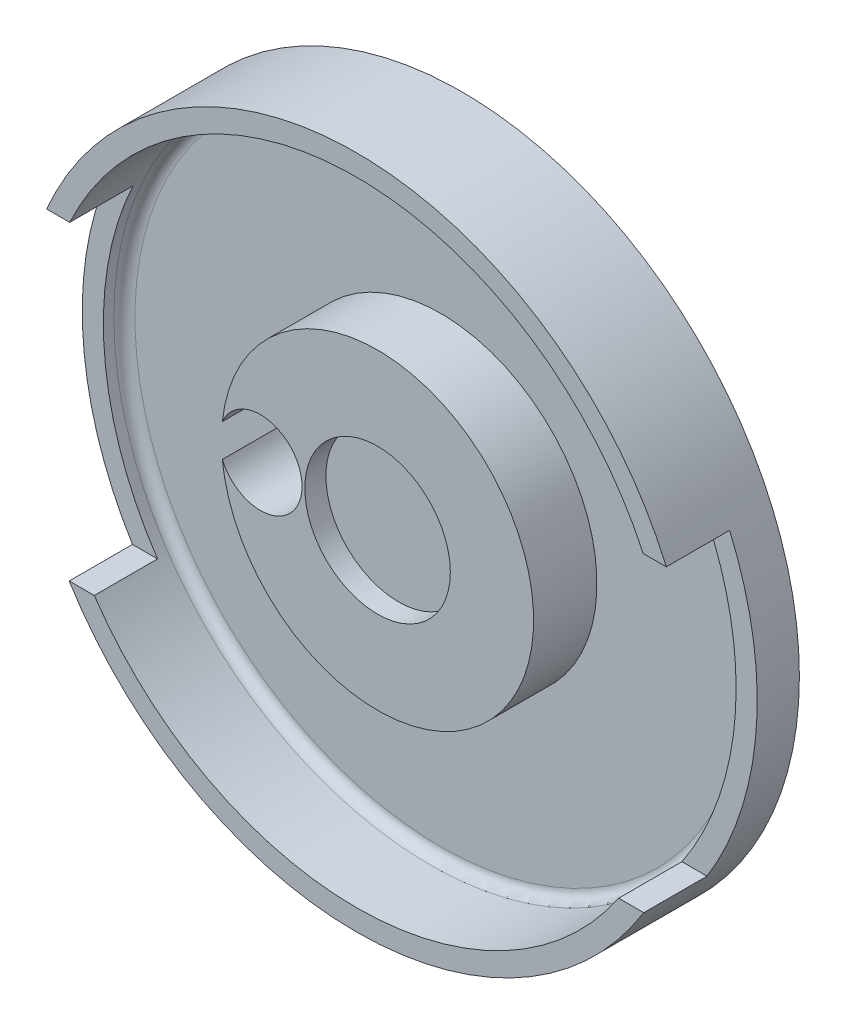
from build123d import *

# Parameters (mm, degrees)
SKETCH1_R           = 16
BOSS_EXTRUDE1_DEPTH = 5
SKETCH3_R           = 15
CUT_EXTRUDE1_DEPTH  = 4
FILLET1_R           = 0.5
SKETCH7_W           = 5.268501054
SKETCH7_H           = 14.735182388
CUT_EXTRUDE2_DEPTH  = 11
SKETCH8_R           = 7.4
BOSS_EXTRUDE2_DEPTH = 3
SKETCH9_R           = 3.45
CUT_EXTRUDE3_DEPTH  = 1
SKETCH11_R          = 1.969447503
CUT_EXTRUDE4_DEPTH  = 10


with BuildPart() as part:
    # Sketch1 → Boss-Extrude1 (new body)
    with BuildSketch(Plane.XY):
        Circle(SKETCH1_R)
    extrude(amount=BOSS_EXTRUDE1_DEPTH)

    # Sketch3 → Cut-Extrude1 (cut)
    with BuildSketch(Plane.XY.offset(5)):
        Circle(SKETCH3_R)
    extrude(amount=-CUT_EXTRUDE1_DEPTH, mode=Mode.SUBTRACT)

    # Fillet1
    fillet1_edges = [part.edges().sort_by_distance(p)[0] for p in [
        (-15, 0, 1),
    ]]
    fillet(fillet1_edges, radius=FILLET1_R)

    # Sketch7 → Cut-Extrude2 (cut)
    with BuildSketch(Plane.XY.offset(13)):
        with Locations((-14.456252894, -1.028256592)):
            Rectangle(SKETCH7_W, SKETCH7_H)
    cut_extrude2 = extrude(amount=-CUT_EXTRUDE2_DEPTH, mode=Mode.SUBTRACT)

    # Mirror1: Cut-Extrude2 across plane
    add(cut_extrude2.mirror(Plane(origin=(0, 0, 0), x_dir=(0, 0, 1), z_dir=(1, 0, 0))), mode=Mode.SUBTRACT)

    # Sketch8 → Boss-Extrude2 (add)
    with BuildSketch(Plane.XY.offset(1)):
        Circle(SKETCH8_R)
    extrude(amount=BOSS_EXTRUDE2_DEPTH)

    # Sketch9 → Cut-Extrude3 (cut)
    with BuildSketch(Plane.XY.offset(4)):
        Circle(SKETCH9_R)
    extrude(amount=-CUT_EXTRUDE3_DEPTH, mode=Mode.SUBTRACT)

    # Sketch11 → Cut-Extrude4 (cut)
    with BuildSketch(Plane.XY.offset(4)):
        with Locations((-5.549660814, 0)):
            Circle(SKETCH11_R)
    extrude(amount=-CUT_EXTRUDE4_DEPTH, mode=Mode.SUBTRACT)


solid = part.part
